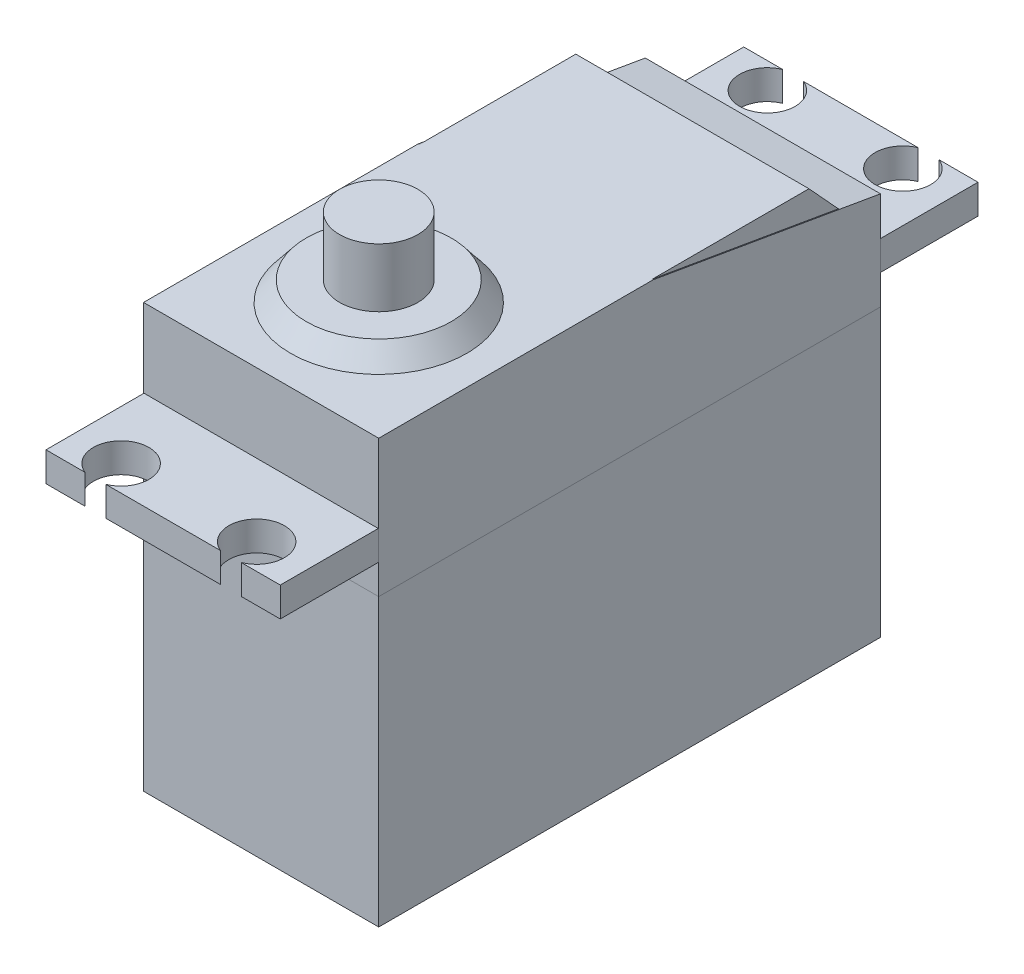
from build123d import *

# Parameters (mm, degrees)
SKETCH1_W            = 19.05
SKETCH1_H            = 40.64
BOSS_EXTRUDE1_DEPTH  = 23.8125
CHAMFER1_SIZE        = 0.635
SKETCH2_W            = 6.35
SKETCH2_H            = 3.175
BOSS_EXTRUDE3_DEPTH  = 1.27
SKETCH6_W            = 19.05
SKETCH6_H            = 40.64
BOSS_EXTRUDE6_DEPTH  = 11.1125
CUT_EXTRUDE1_DEPTH   = 48.895167087
BOSS_EXTRUDE7_DEPTH  = 18.8849
SKETCH13_R           = 5.87375
SKETCH12_R           = 7.14375
SKETCH14_R           = 3.175
BOSS_EXTRUDE8_DEPTH  = 4.7625
SKETCH15_W           = 18.975487788
SKETCH15_H           = 2.38125
BOSS_EXTRUDE9_DEPTH  = 7.9375
SKETCH16_W           = 18.975487788
SKETCH16_H           = 2.38125
BOSS_EXTRUDE10_DEPTH = 7.9375
SKETCH17_R           = 2.25
CUT_EXTRUDE2_DEPTH   = 43.179728618


with BuildPart() as part:
    # Sketch1 → Boss-Extrude1 (new body)
    with BuildSketch(Plane(origin=(0, 0, 0), x_dir=(1, 0, 0), z_dir=(0, 1, 0))):
        with Locations((0, 1.27)):
            Rectangle(SKETCH1_W, SKETCH1_H)
    extrude(amount=BOSS_EXTRUDE1_DEPTH)

    # Chamfer1
    chamfer1_edges = [part.edges().sort_by_distance(p)[0] for p in [
        (0, 0, -21.59),
        (9.525, 0, -1.27),
        (0, 0, 19.05),
        (-9.525, 0, -1.27),
    ]]
    chamfer(chamfer1_edges, length=CHAMFER1_SIZE)

    # Sketch2 → Boss-Extrude3 (add)
    with BuildSketch(Plane(origin=(0, 0, -21.59), x_dir=(-1, 0, 0), z_dir=(0, 0, -1))):
        with Locations((0, 2.2225)):
            Rectangle(SKETCH2_W, SKETCH2_H)
    extrude(amount=BOSS_EXTRUDE3_DEPTH)

    # Sketch4 → Loft1 section 0
    with BuildSketch(Plane(origin=(0, 0, -22.86), x_dir=(-1, 0, 0), z_dir=(0, 0, -1))):
        with BuildLine():
            Line((2.9972, 3.6322), (-2.9972, 3.6322))
            Line((-2.9972, 3.6322), (-2.9972, 0.8128))
            Line((-2.9972, 0.8128), (2.9972, 0.8128))
            Line((2.9972, 0.8128), (2.9972, 3.6322))
        make_face()
    # Sketch3 → Loft1 section 1
    with BuildSketch(Plane(origin=(0, 0, -26.67), x_dir=(-1, 0, 0), z_dir=(0, 0, -1))):
        with BuildLine():
            Line((2.38125, 3.01625), (-2.38125, 3.01625))
            Line((-2.38125, 3.01625), (-2.38125, 1.42875))
            Line((-2.38125, 1.42875), (2.38125, 1.42875))
            Line((2.38125, 1.42875), (2.38125, 3.01625))
        make_face()
    loft()


with BuildPart() as body_2:
    # Sketch6 → Boss-Extrude6 (new body)
    with BuildSketch(Plane(origin=(0, 23.8125, 0), x_dir=(1, 0, 0), z_dir=(0, 1, 0))):
        with Locations((0, 1.27)):
            Rectangle(SKETCH6_W, SKETCH6_H)
    extrude(amount=BOSS_EXTRUDE6_DEPTH)

    # Sketch8 → Cut-Extrude1 (cut, through all)
    with BuildSketch(Plane(origin=(9.525, 0, 0), x_dir=(0, 0, -1), z_dir=(1, 0, 0))):
        Polygon((21.59, 31.75), (3.175, 34.925), (21.59, 34.925), align=None)
    extrude(amount=-CUT_EXTRUDE1_DEPTH, mode=Mode.SUBTRACT)

    # Sketch11 → Boss-Extrude7 (add)
    with BuildSketch(Plane(origin=(9.4488, 0, 0), x_dir=(0, 0, -1), z_dir=(1, 0, 0))):
        Polygon((3.175, 34.925), (15.875, 34.925), (18.25625, 32.324784483), align=None)
    extrude(amount=-BOSS_EXTRUDE7_DEPTH)

    # Sketch13 → Loft5 section 0
    with BuildSketch(Plane(origin=(0, 36.5125, 0), x_dir=(-1, 0, 0), z_dir=(0, 1, 0))):
        with Locations((0, 9.525)):
            Circle(SKETCH13_R)
    # Sketch12 → Loft5 section 1
    with BuildSketch(Plane(origin=(0, 34.925, 0), x_dir=(1, 0, 0), z_dir=(0, 1, 0))):
        with Locations((0, -9.525)):
            Circle(SKETCH12_R)
    loft()

    # Sketch14 → Boss-Extrude8 (add)
    with BuildSketch(Plane(origin=(0, 36.5125, 0), x_dir=(1, 0, 0), z_dir=(0, 1, 0))):
        with Locations(Location((0, -9.525, 0), (0, 0, 90))):
            Circle(SKETCH14_R)
    extrude(amount=BOSS_EXTRUDE8_DEPTH)

    # Sketch15 → Boss-Extrude9 (add)
    with BuildSketch(Plane(origin=(0, 0, -21.59), x_dir=(-1, 0, 0), z_dir=(0, 0, -1))):
        with Locations((0, 27.384375)):
            Rectangle(SKETCH15_W, SKETCH15_H)
    extrude(amount=BOSS_EXTRUDE9_DEPTH)

    # Sketch16 → Boss-Extrude10 (add)
    with BuildSketch(Plane.XY.offset(19.05)):
        with Locations((0, 27.384375)):
            Rectangle(SKETCH16_W, SKETCH16_H)
    extrude(amount=BOSS_EXTRUDE10_DEPTH)

    # Sketch17 → Cut-Extrude2 (cut, through all)
    with BuildSketch(Plane(origin=(0, 28.575, 0), x_dir=(1, 0, 0), z_dir=(0, 1, 0))):
        with Locations((5.487743894, -24.901198221)):
            Circle(SKETCH17_R)
        with Locations((-5.487743894, -24.901198221)):
            Circle(SKETCH17_R)
        with Locations((-5.487743894, 27.441198221)):
            Circle(SKETCH17_R)
        with Locations((5.487743894, 27.441198221)):
            Circle(SKETCH17_R)
    extrude(amount=-CUT_EXTRUDE2_DEPTH, mode=Mode.SUBTRACT)


solid = Compound([part.part, body_2.part])
